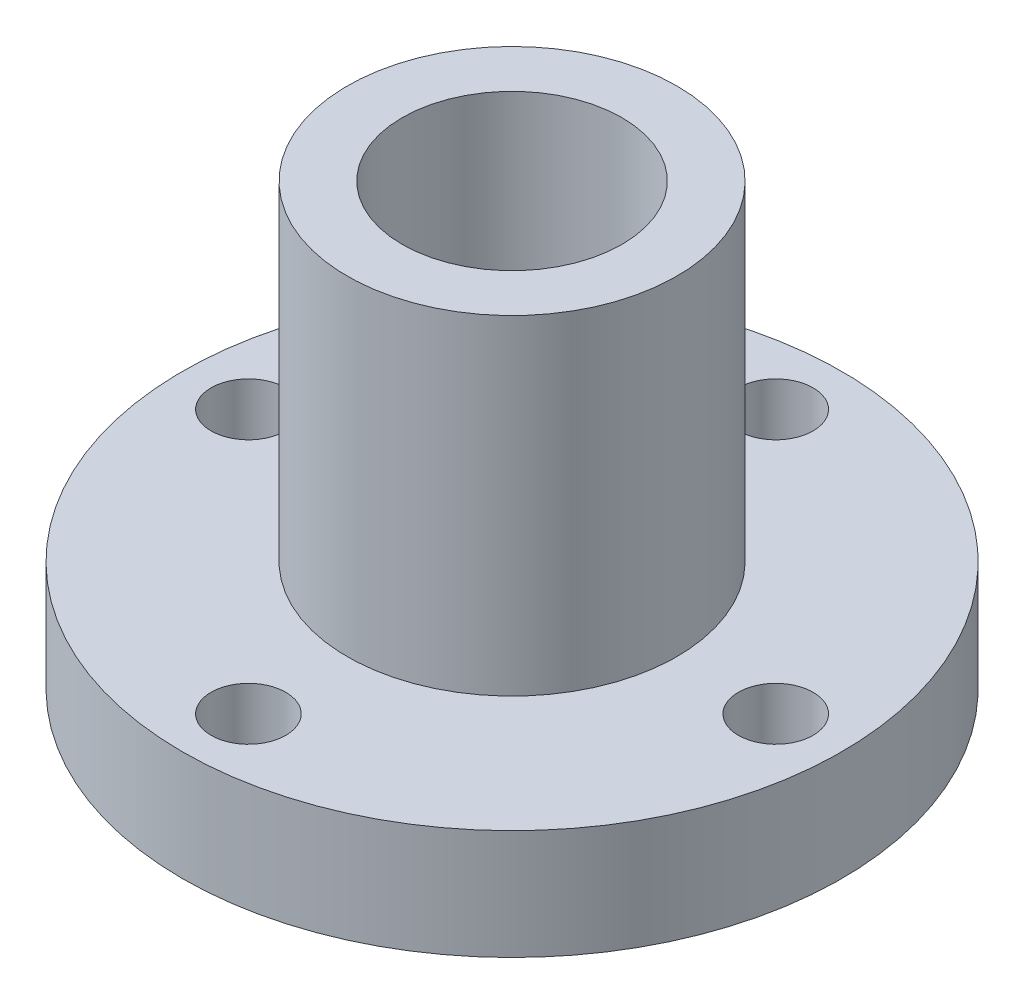
from build123d import *

# Parameters (mm, degrees)
SKETCH1_R           = 19.05
SKETCH1_R_2         = 6.35
BOSS_EXTRUDE1_DEPTH = 6.35
SKETCH2_R           = 9.525
SKETCH2_R_2         = 6.35
BOSS_EXTRUDE2_DEPTH = 19.05
SKETCH3_R           = 2.159
CUT_EXTRUDE1_DEPTH  = 11.938


with BuildPart() as part:
    # Sketch1 → Boss-Extrude1 (new body)
    with BuildSketch(Plane(origin=(0, 0, 0), x_dir=(1, 0, 0), z_dir=(0, 1, 0))):
        with Locations(Location((0, 0, 0), (0, 0, 270))):
            Circle(SKETCH1_R)
        with Locations(Location((0, 0, 0), (0, 0, 270))):
            Circle(SKETCH1_R_2, mode=Mode.SUBTRACT)
    extrude(amount=BOSS_EXTRUDE1_DEPTH)

    # Sketch2 → Boss-Extrude2 (add)
    with BuildSketch(Plane(origin=(0, 6.35, 0), x_dir=(1, 0, 0), z_dir=(0, 1, 0))):
        with Locations(Location((0, 0, 0), (0, 0, 90))):
            Circle(SKETCH2_R)
        with Locations(Location((0, 0, 0), (0, 0, 270))):
            Circle(SKETCH2_R_2, mode=Mode.SUBTRACT)
    extrude(amount=BOSS_EXTRUDE2_DEPTH)

    # Sketch3 → Cut-Extrude1 (cut)
    with BuildSketch(Plane(origin=(0, 6.35, 0), x_dir=(1, 0, 0), z_dir=(0, 1, 0))):
        with Locations(Location((0, 15.24, 0), (0, 0, 270))):
            Circle(SKETCH3_R)
        with Locations(Location((15.24, 0, 0), (0, 0, 270))):
            Circle(SKETCH3_R)
        with Locations(Location((0, -15.24, 0), (0, 0, 270))):
            Circle(SKETCH3_R)
        with Locations(Location((-15.24, 0, 0), (0, 0, 270))):
            Circle(SKETCH3_R)
    extrude(amount=-CUT_EXTRUDE1_DEPTH, mode=Mode.SUBTRACT)


solid = part.part
